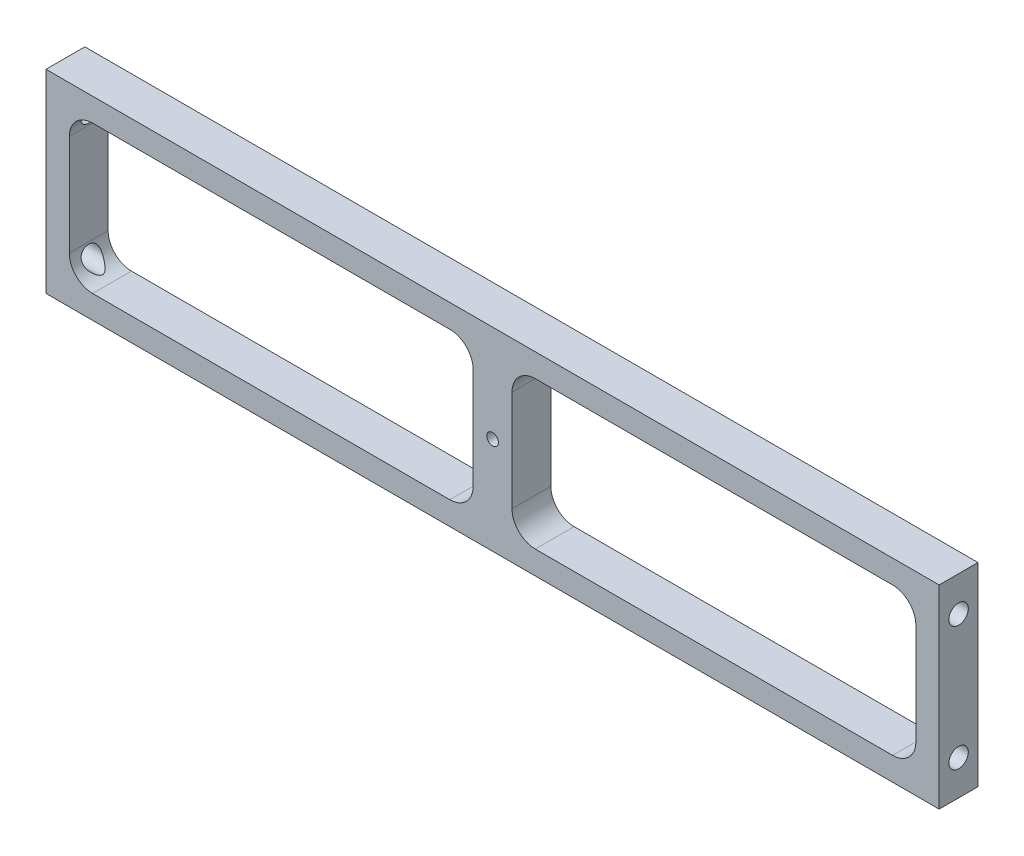
from build123d import *

# Parameters (mm, degrees)
SKETCH_1_W          = 5
SKETCH_1_H          = 38
EXTRUDE_1_DEPTH     = 10
FILLET_1_R          = 6
SKETCH_8_R          = 2.5
CUT_EXTRUDE_4_DEPTH = 91
CUT_EXTRUDE_START   = -91
SKETCH_10_R         = 2.5
CUT_EXTRUDE_5_DEPTH = 91
SKETCH_15_R         = 1.5
CUT_EXTRUDE_9_DEPTH = 10


with BuildPart() as part:
    # 草图1 → 凸台-拉伸1 (new body)
    with BuildSketch(Plane.XY):
        Polygon((6, 6), (6, 44), (110, 44), (115, 44), (115, 50), (0, 50), (0, 0), (115, 0), (115, 6), (110, 6), align=None)
        with Locations((117.5, 25)):
            Rectangle(SKETCH_1_W, SKETCH_1_H)
        with Locations((112.5, 25)):
            Rectangle(SKETCH_1_W, SKETCH_1_H)
        Polygon((115, 50), (115, 44), (120, 44), (224, 44), (224, 6), (120, 6), (115, 6), (115, 0), (230, 0), (230, 50), align=None)
    extrude(amount=EXTRUDE_1_DEPTH)

    # 圆角1
    fillet_1_edges = [part.edges().sort_by_distance(p)[0] for p in [
        (110, 44, 5),
        (6, 44, 5),
        (6, 6, 5),
        (110, 6, 5),
        (120, 6, 5),
        (224, 6, 5),
        (224, 44, 5),
        (120, 44, 5),
    ]]
    fillet(fillet_1_edges, radius=FILLET_1_R)

    # 草图8 → 切除-拉伸4 (cut)
    with BuildSketch(Plane.ZY):
        with Locations((5, 41)):
            Circle(SKETCH_8_R)
        with Locations((5, 9)):
            Circle(SKETCH_8_R)
    extrude(amount=-CUT_EXTRUDE_4_DEPTH, mode=Mode.SUBTRACT)

    # 草图10 → 切除-拉伸5 (cut)
    with BuildSketch(Plane(origin=(230, 0, 0), x_dir=(0, 0, -1), z_dir=(1, 0, 0)).offset(CUT_EXTRUDE_START)):
        with Locations(Location((-5, 41, 0), (0, 0, 180))):
            Circle(SKETCH_10_R)
        with Locations(Location((-5, 9, 0), (0, 0, 180))):
            Circle(SKETCH_10_R)
    extrude(amount=CUT_EXTRUDE_5_DEPTH, mode=Mode.SUBTRACT)

    # 草图15 → 切除-拉伸9 (cut)
    with BuildSketch(Plane.XY.offset(10)):
        with Locations((115, 25)):
            Circle(SKETCH_15_R)
    extrude(amount=-CUT_EXTRUDE_9_DEPTH, mode=Mode.SUBTRACT)


solid = part.part
